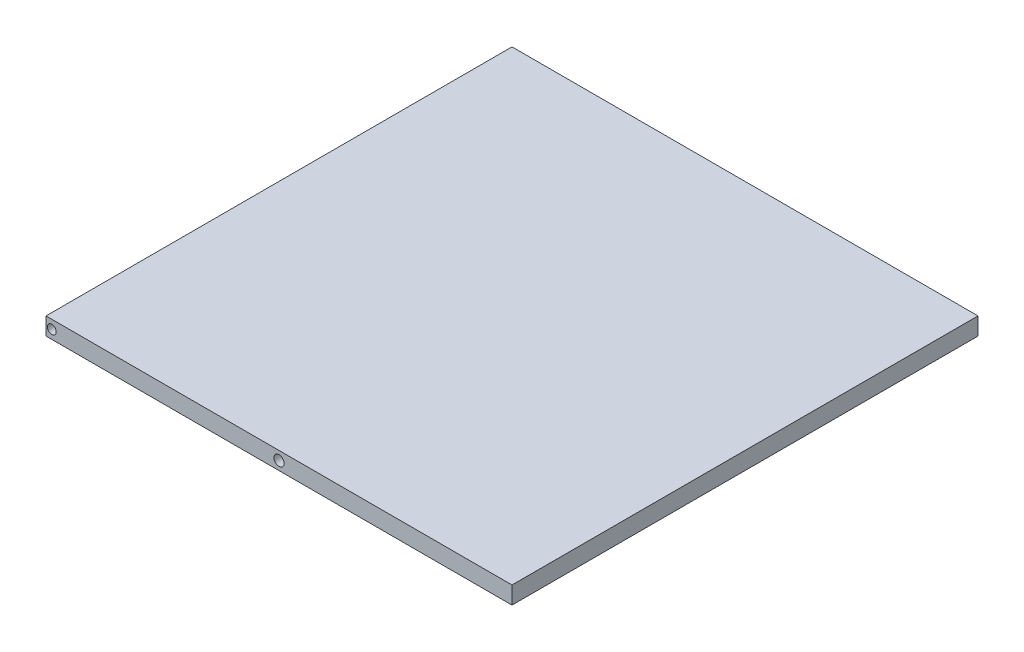
from build123d import *

# Parameters (mm, degrees)
SKETCH2_W           = 508
SKETCH2_H           = 508
BOSS_EXTRUDE1_DEPTH = 19.05
SKETCH3_R           = 5.523864606
SKETCH3_R_2         = 4.826
CUT_EXTRUDE1_DEPTH  = 719.673015008


with BuildPart() as part:
    # Sketch2 → Boss-Extrude1 (new body)
    with BuildSketch(Plane(origin=(0, 0, 0), x_dir=(1, 0, 0), z_dir=(0, 1, 0))):
        with Locations((-254, 254)):
            Rectangle(SKETCH2_W, SKETCH2_H)
    extrude(amount=BOSS_EXTRUDE1_DEPTH)

    # Sketch3 → Cut-Extrude1 (cut, through all)
    with BuildSketch(Plane.XY):
        with Locations((-254, 9.525)):
            Circle(SKETCH3_R)
        with Locations((-501.65, 9.525)):
            Circle(SKETCH3_R_2)
    extrude(amount=-CUT_EXTRUDE1_DEPTH, mode=Mode.SUBTRACT)


solid = part.part
